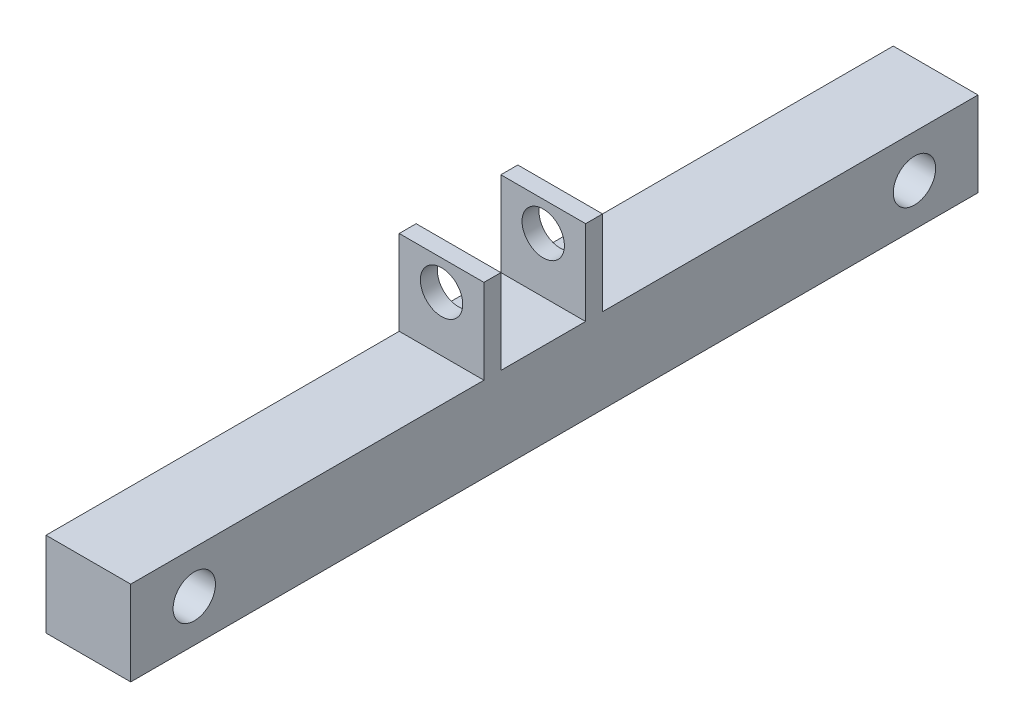
from build123d import *

# Parameters (mm, degrees)
SKETCH1_W           = 20
SKETCH1_H           = 20
BOSS_EXTRUDE1_DEPTH = 200
SKETCH3_R           = 5
CUT_EXTRUDE1_DEPTH  = 57
SKETCH4_W           = 20
SKETCH4_H           = 4
BOSS_EXTRUDE2_DEPTH = 20
SKETCH5_R           = 5
CUT_EXTRUDE2_DEPTH  = 49


with BuildPart() as part:
    # Sketch1 → Boss-Extrude1 (new body)
    with BuildSketch(Plane.XY):
        Rectangle(SKETCH1_W, SKETCH1_H)
    extrude(amount=BOSS_EXTRUDE1_DEPTH)

    # Sketch3 → Cut-Extrude1 (cut)
    with BuildSketch(Plane.ZY.offset(10)):
        with Locations(Location((15, 0, 0), (0, 0, 270))):
            Circle(SKETCH3_R)
        with Locations(Location((185, 0, 0), (0, 0, 270))):
            Circle(SKETCH3_R)
    extrude(amount=-CUT_EXTRUDE1_DEPTH, mode=Mode.SUBTRACT)

    # Sketch4 → Boss-Extrude2 (add)
    with BuildSketch(Plane(origin=(0, 10, 0), x_dir=(1, 0, 0), z_dir=(0, 1, 0))):
        with Locations((0, -114.625901795)):
            Rectangle(SKETCH4_W, SKETCH4_H)
        with Locations((0, -90.625901795)):
            Rectangle(SKETCH4_W, SKETCH4_H)
    extrude(amount=BOSS_EXTRUDE2_DEPTH)

    # Sketch5 → Cut-Extrude2 (cut)
    with BuildSketch(Plane(origin=(0, 0, 88.625901795), x_dir=(-1, 0, 0), z_dir=(0, 0, -1))):
        with Locations((0, 23)):
            Circle(SKETCH5_R)
    extrude(amount=-CUT_EXTRUDE2_DEPTH, mode=Mode.SUBTRACT)


solid = part.part
